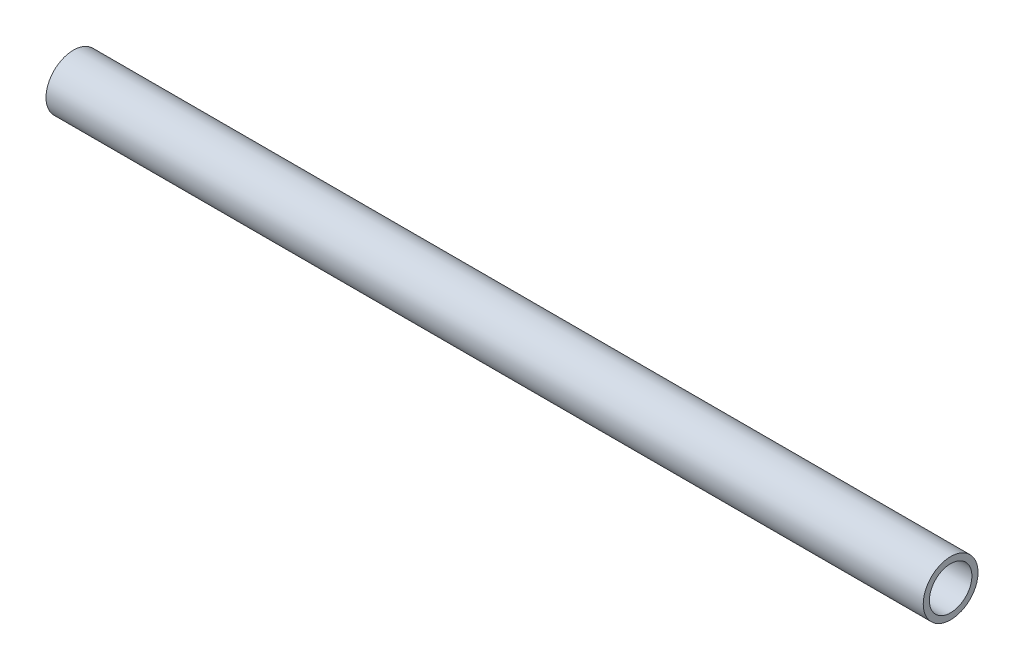
from build123d import *

# Parameters (mm, degrees)
SKETCH3_W = 101.6
SKETCH3_H = 0.7112


with BuildPart() as part:
    # Sketch3 → Revolve1 (revolve)
    with BuildSketch(Plane.XY, mode=Mode.PRIVATE) as revolve1_sk:
        with Locations((0, 2.8194)):
            Rectangle(SKETCH3_W, SKETCH3_H)
    revolve(revolve1_sk.sketch.rotate(Axis((-50.8, 0, 0), (1, 0, 0)), 90), axis=Axis((-50.8, 0, 0), (1, 0, 0)))


solid = part.part
